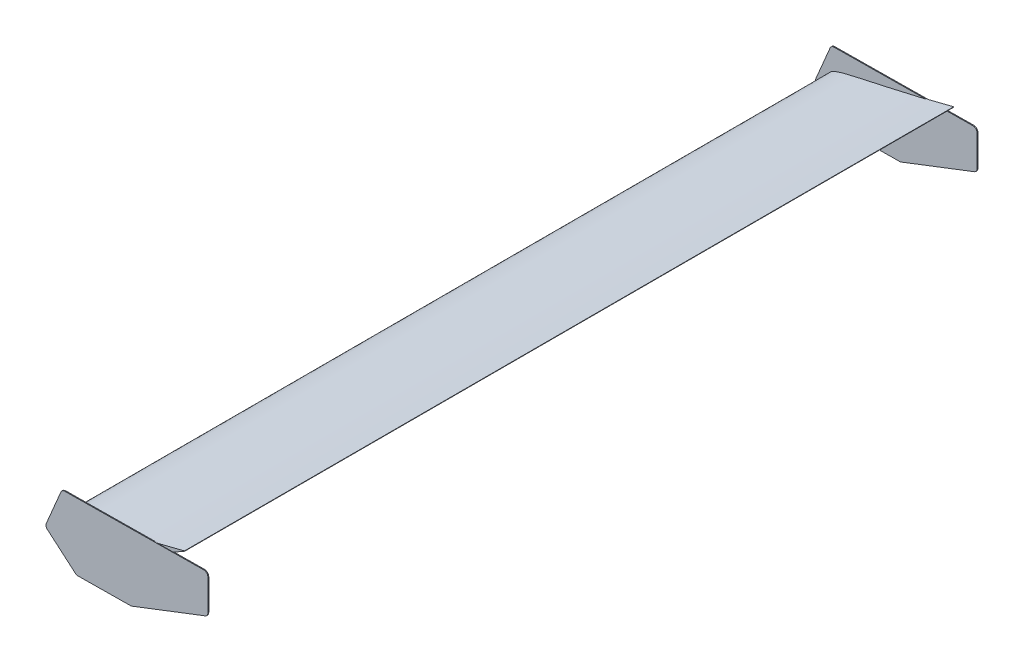
from build123d import *

# Parameters (mm, degrees)
REAR_WING_DEPTH              = 900
ENDPLATE_DEPTH               = 1
ENDPLATE_FILLET_R            = 10
ENDPLATE_FILLET_OF_MIRROR3_R = 10


with BuildPart() as part:
    # AirfoilSketch → Rear Wing (new, symmetric)
    with BuildSketch(Plane.XY):
        with BuildLine():
            Line((289.777992749, 77.645779141), (289.978891985, 76.892095191))
            add(Edge.make_bspline(
                [(289.978891985, 76.892095191), (285.502776828, 74.291772359), (276.572147653, 69.103675508), (258.552213317, 59.195472899), (235.832613079, 47.49915358), (208.200578325, 34.573706685), (180.341535978, 22.590272594), (152.141156589, 11.822470505), (123.638855092, 2.197501189), (99.428656251, -4.276385952), (79.737554075, -8.092504169), (64.747405651, -10.201139063), (49.502929403, -11.481749168), (36.611356426, -11.571245652), (26.106904712, -10.991110902), (18.026451701, -9.953976824), (10.950525907, -8.389094964), (4.526757874, -5.973368857), (-1.823166345, -1.026815446), (1.983634928, 5.065409194), (6.661501855, 8.305430923), (12.48845941, 11.203902636), (19.595257537, 13.782232198), (29.148906614, 16.812875179), (41.243240975, 20.000440488), (55.848565247, 23.459078085), (70.54142306, 26.548227327), (90.107650027, 30.795679686), (114.569323768, 36.073825639), (143.852942157, 42.713060191), (173.159301147, 49.229557623), (202.420640768, 55.926091162), (231.611695395, 62.895633399), (255.872896925, 68.95057924), (275.26594148, 73.848574366), (284.940729391, 76.380066998), (289.777992749, 77.645779141)],
                knots=[0, 0, 0, 0, 0.025304886, 0.050487653, 0.100520433, 0.150190716, 0.199586607, 0.248740009, 0.297715539, 0.346600594, 0.371102737, 0.395726297, 0.420570145, 0.445825119, 0.458702216, 0.471919982, 0.485786003, 0.493461051, 0.506863029, 0.51614777, 0.522766003, 0.535269014, 0.547551134, 0.559786371, 0.584228898, 0.60868081, 0.633151284, 0.657621757, 0.706558114, 0.75548187, 0.804405627, 0.853320224, 0.902221408, 0.951113136, 0.975557228, 1, 1, 1, 1], degree=3))
        make_face()
    extrude(amount=REAR_WING_DEPTH, both=True)

    # Endplate Sketch → Endplate (add, symmetric)
    with BuildSketch(Plane.XY.offset(900)):
        Polygon((4.198364617, 59.406656961), (-35.29092082, -33.850525596), (38.257501257, -96.733844985), (166.27509038, -95.421105135), (345.667321655, -26.31860721), (345.667321655, 62.908206322), align=None)
    endplate = extrude(amount=ENDPLATE_DEPTH, both=True)

    # Endplate Fillet
    endplate_fillet_edges = [part.edges().sort_by_distance(p)[0] for p in [
        (345.667321655, 62.908206322, 900),
        (4.198364617, 59.406656961, 900),
        (-35.29092082, -33.850525596, 900),
        (38.257501257, -96.733844985, 900),
        (166.27509038, -95.421105135, 900),
        (345.667321655, -26.31860721, 900),
    ]]
    fillet(endplate_fillet_edges, radius=ENDPLATE_FILLET_R)

    # Mirror3: Endplate across plane
    add(endplate.mirror(Plane.XY))

    # Endplate Fillet of Mirror3
    endplate_fillet_of_mirror3_edges = [part.edges().sort_by_distance(p)[0] for p in [
        (345.667321655, 62.908206322, -900),
        (4.198364617, 59.406656961, -900),
        (-35.29092082, -33.850525596, -900),
        (38.257501257, -96.733844985, -900),
        (166.27509038, -95.421105135, -900),
        (345.667321655, -26.31860721, -900),
    ]]
    fillet(endplate_fillet_of_mirror3_edges, radius=ENDPLATE_FILLET_OF_MIRROR3_R)


solid = part.part
